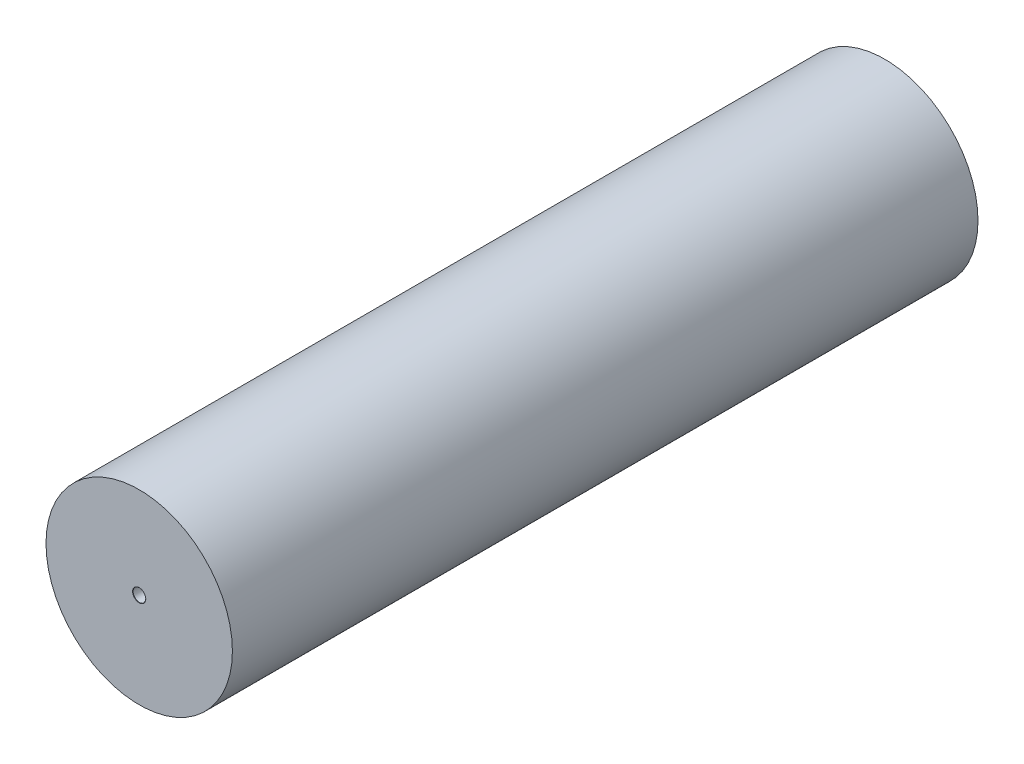
from build123d import *

# Parameters (mm, degrees)
SKETCH1_R           = 127
BOSS_EXTRUDE1_DEPTH = 1016


with BuildPart() as part:
    # Sketch1 → Boss-Extrude1 (new body)
    with BuildSketch(Plane.XY):
        Circle(SKETCH1_R)
    extrude(amount=BOSS_EXTRUDE1_DEPTH)

    # Sketch6 → 3/8 Rc Tapped Hole2 (revolve, cut)
    with BuildSketch(Plane(origin=(0, 2.353512808, 1016), x_dir=(0, -1, 0), z_dir=(1, 0, 0))):
        Polygon((0, 0), (0, 1016), (25, 1016), (25, 20.32), (7.985917585, 20.32), (8.6094525, 0.3455475), (8.955, 0), align=None)
    revolve(axis=Axis((0, 2.353512808, 1022.35), (0, 0, -1)), mode=Mode.SUBTRACT)


solid = part.part
